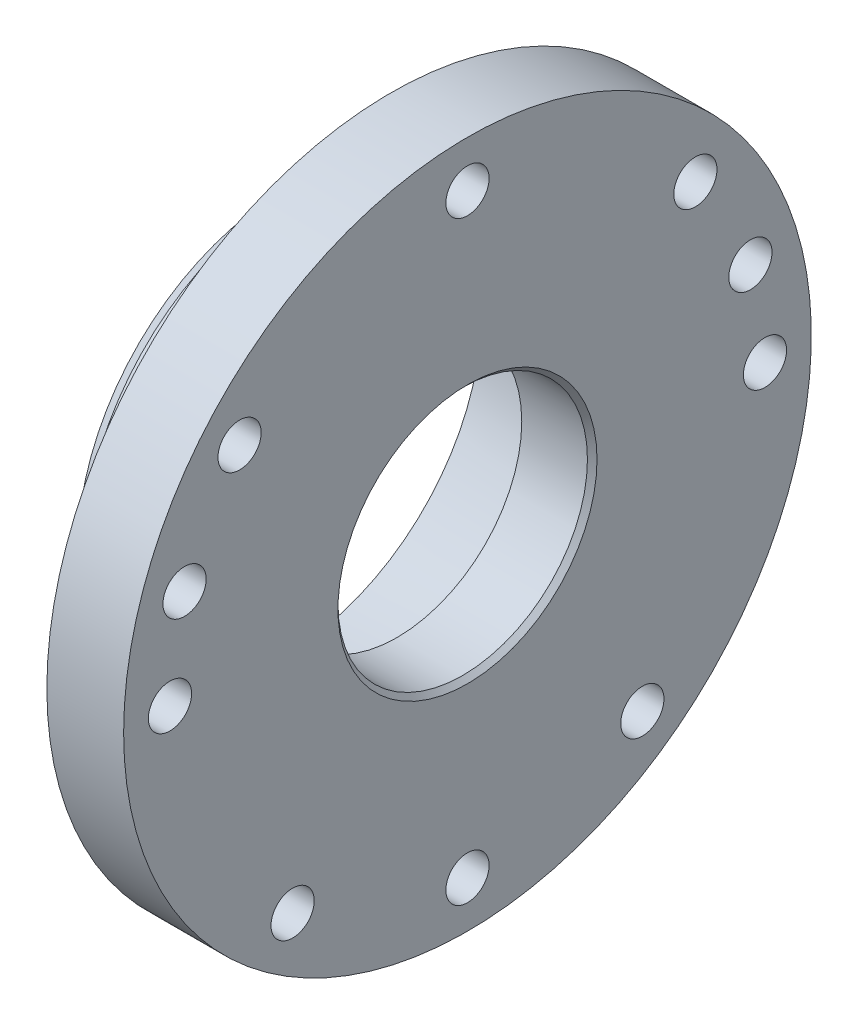
from build123d import *

# Parameters (mm, degrees)
CHAMFER2_SIZE      = 1.5875
SKETCH3_R          = 7.1501
CUT_EXTRUDE1_DEPTH = 165.675089552
CIRPATTERN1_COUNT  = 5
FILLET1_R          = 0.762
CHAMFER3_SIZE      = 3.175
CHAMFER3_SIZE2     = 1.5875
SKETCH4_R          = 7.1501
CUT_EXTRUDE2_DEPTH = 165.675089552
SKETCH5_R          = 7.1501
CUT_EXTRUDE3_DEPTH = 165.675089552
CIRPATTERN2_COUNT  = 36
SKETCH8_W          = 12.7
SKETCH8_H          = 15.875
CUT_EXTRUDE4_DEPTH = 172.890277093


with BuildPart() as part:
    # Sketch1 → Revolve1 (revolve)
    with BuildSketch(Plane.XY, mode=Mode.PRIVATE) as revolve1_sk:
        with BuildLine():
            Line((0, 65.0875), (0, 70.0151))
            Line((0, 70.0151), (35.1028, 70.0151))
            Line((35.1028, 70.0151), (35.1028, 113.7666))
            Line((35.1028, 113.7666), (60.5028, 113.7666))
            Line((60.5028, 113.7666), (60.5028, 41.275))
            Line((60.5028, 41.275), (37.1856, 41.275))
            Line((37.1856, 41.275), (37.1856, 54.851738008))
            ThreePointArc((37.1856, 54.851738008), (35.183653306, 59.99973539), (30.22972676, 62.442741607))
            Line((30.22972676, 62.442741607), (0, 65.0875))
        make_face()
    revolve(revolve1_sk.sketch.rotate(Axis((0, 0, 0), (1, 0, 0)), 90), axis=Axis((0, 0, 0), (1, 0, 0)))

    # Chamfer2
    chamfer2_edges = [part.edges().sort_by_distance(p)[0] for p in [
        (60.5028, 0, -41.275),
    ]]
    chamfer(chamfer2_edges, length=CHAMFER2_SIZE)

    # Sketch3 → Cut-Extrude1 (cut, through all)
    with BuildSketch(Plane.ZY.offset(-35.1028)):
        with Locations((0, 98.425)):
            Circle(SKETCH3_R)
    cut_extrude1 = extrude(amount=-CUT_EXTRUDE1_DEPTH, mode=Mode.SUBTRACT)

    # CirPattern1: Cut-Extrude1 ×5 about axis
    cirpattern1_axis = Axis((0, 0, 0), (1, 0, 0))
    for i in range(1, CIRPATTERN1_COUNT):
        add(cut_extrude1.rotate(cirpattern1_axis, i * 360 / CIRPATTERN1_COUNT), mode=Mode.SUBTRACT)

    # Fillet1
    fillet1_edges = [part.edges().sort_by_distance(p)[0] for p in [
        (35.1028, 0, -70.0151),
    ]]
    fillet(fillet1_edges, radius=FILLET1_R)

    # Chamfer3
    chamfer3_edges = [part.edges().sort_by_distance(p)[0] for p in [
        (0, 0, -70.0151),
    ]]
    chamfer3_side = [part.faces().sort_by_distance(p)[0] for p in [
        (17.1704, 0, -70.0151),
    ]]
    chamfer(chamfer3_edges, length=CHAMFER3_SIZE, length2=CHAMFER3_SIZE2, reference=chamfer3_side[0])

    # Sketch4 → Cut-Extrude2 (cut, through all)
    with BuildSketch(Plane.ZY.offset(-35.1028)):
        with Locations((-98.425, 0)):
            Circle(SKETCH4_R)
    cut_extrude2 = extrude(amount=-CUT_EXTRUDE2_DEPTH, mode=Mode.SUBTRACT)

    # Mirror1: Cut-Extrude2 across plane
    add(cut_extrude2.mirror(Plane.XY), mode=Mode.SUBTRACT)

    # Sketch5 → Cut-Extrude3 (cut, through all)
    with BuildSketch(Plane.ZY.offset(-35.1028)):
        with Locations((0, -98.425)):
            Circle(SKETCH5_R)
    cut_extrude3 = extrude(amount=-CUT_EXTRUDE3_DEPTH, mode=Mode.SUBTRACT)

    # CirPattern2: Cut-Extrude3 ×36 about axis, 33 skipped
    cirpattern2_axis = Axis((0, 0, 0), (-1, 0, 0))
    add([cut_extrude3.rotate(cirpattern2_axis, i * 360 / CIRPATTERN2_COUNT) for i in range(1, CIRPATTERN2_COUNT) if i not in (1, 2, 3, 4, 5, 6, 7, 8, 9, 10, 11, 12, 14, 15, 16, 17, 18, 19, 20, 21, 22, 24, 25, 26, 27, 28, 29, 30, 31, 32, 33, 34, 35)], mode=Mode.SUBTRACT)

    # Sketch7 → Cut-Revolve1 (revolve, cut)
    with BuildSketch(Plane.XY, mode=Mode.PRIVATE) as cut_revolve1_sk:
        Polygon((20.8788, 70.0151), (20.8788, 67.1449), (25.6794, 67.1449), (25.6794, 70.0151), (25.6794, 72.174819971), (20.8788, 72.174819971), align=None)
    revolve(cut_revolve1_sk.sketch.rotate(Axis((-34.095628325, 0, 0), (1, 0, 0)), 270), axis=Axis((-34.095628325, 0, 0), (1, 0, 0)), mode=Mode.SUBTRACT)

    # Sketch8 → Cut-Extrude4 (cut, through all)
    with BuildSketch(Plane(origin=(0, 0, 0), x_dir=(1, 0, 0), z_dir=(0, 1, 0))):
        with Locations((6.35, 0)):
            Rectangle(SKETCH8_W, SKETCH8_H)
    extrude(amount=-CUT_EXTRUDE4_DEPTH, mode=Mode.SUBTRACT)


solid = part.part
